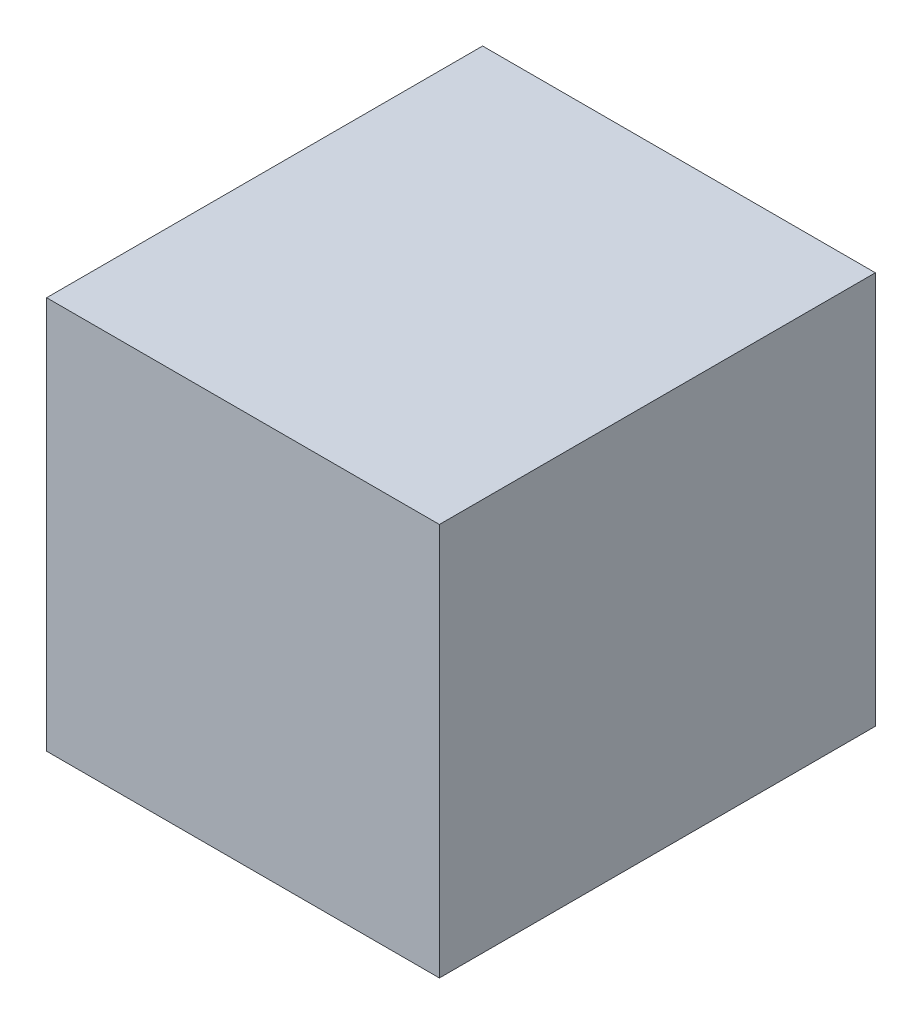
from build123d import *

# Parameters (mm, degrees)
SKETCH_1_W      = 10
SKETCH_1_H      = 11.1
EXTRUDE_1_DEPTH = 10


with BuildPart() as part:
    # 草图1 → 凸台-拉伸1 (new body)
    with BuildSketch(Plane(origin=(0, 0, 0), x_dir=(1, 0, 0), z_dir=(0, 1, 0))):
        Rectangle(SKETCH_1_W, SKETCH_1_H)
    extrude(amount=EXTRUDE_1_DEPTH)


solid = part.part
